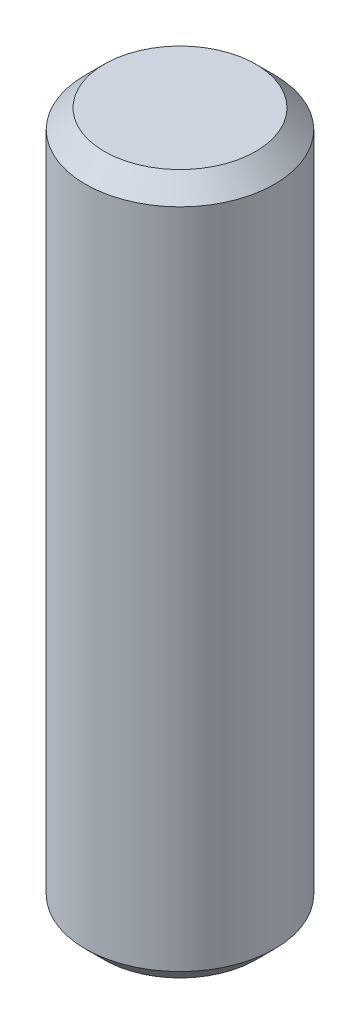
from build123d import *

# Parameters (mm, degrees)
SKETCH1_W     = 10
SKETCH1_H     = 74
CHAMFER1_SIZE = 2


with BuildPart() as part:
    # Sketch1 → Revolve1 (revolve)
    with BuildSketch(Plane(origin=(0, 0, 0), x_dir=(0, 0, -1), z_dir=(1, 0, 0))):
        with Locations((5, 37)):
            Rectangle(SKETCH1_W, SKETCH1_H)
    revolve(axis=Axis((0, 0, 0), (0, 1, 0)))

    # Chamfer1
    chamfer1_edges = [part.edges().sort_by_distance(p)[0] for p in [
        (0, 0, 10),
        (0, 74, 10),
    ]]
    chamfer(chamfer1_edges, length=CHAMFER1_SIZE)


solid = part.part
